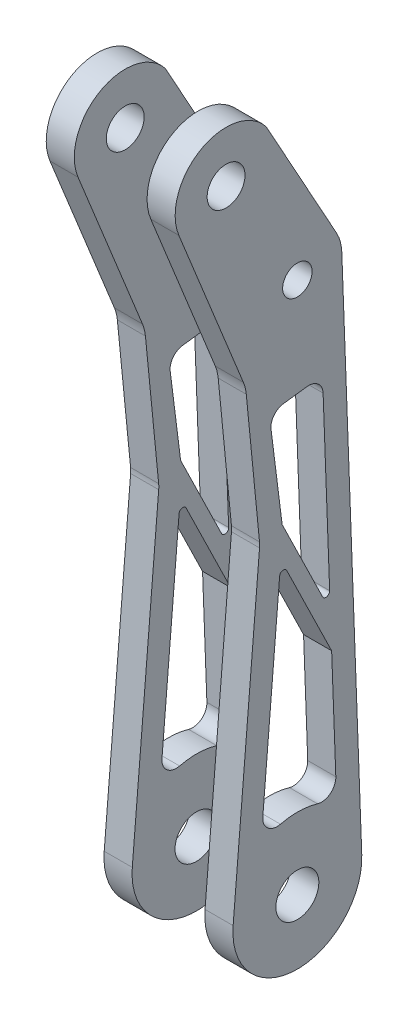
from build123d import *

# Parameters (mm, degrees)
SKETCH6_R           = 3.2639
SKETCH6_R_2         = 4.19989
BOSS_EXTRUDE3_DEPTH = 14.2875
SKETCH7_R           = 4.7625
CUT_EXTRUDE1_DEPTH  = 7.14375
SKETCH8_R           = 7.9375
CUT_EXTRUDE2_DEPTH  = 5.55625
CUT_EXTRUDE3_DEPTH  = 29.21
CUT_EXTRUDE5_DEPTH  = 28.575
FILLET2_R           = 3.175
FILLET3_R           = 3.175
BOSS_EXTRUDE4_DEPTH = 6.223
FILLET4_R           = 0.8255
BOSS_EXTRUDE5_DEPTH = 6.223
FILLET6_R           = 0.8255


with BuildPart() as part:
    # Sketch6 → Boss-Extrude3 (new, symmetric)
    with BuildSketch(Plane(origin=(0, 0, 0), x_dir=(0, 0, -1), z_dir=(1, 0, 0))):
        with BuildLine():
            Line((-8.381868112, 70.779690611), (-14.237180291, 1.198062439))
            ThreePointArc((-14.237180291, 1.198062439), (-0.331752192, -14.283647879), (14.277450567, 0.53578125))
            Line((14.277450567, 0.53578125), (11.553393182, 73.126217476))
            Line((11.553393182, 73.126217476), (9.854739755, 118.39178125))
            ThreePointArc((9.854739755, 118.39178125), (9.530289118, 120.556972634), (8.73611616, 122.597220477))
            Line((8.73611616, 122.597220477), (-6.910022509, 150.896463863))
            ThreePointArc((-6.910022509, 150.896463863), (-21.450180104, 153.711509321), (-26.264611031, 139.705727705))
            Line((-26.264611031, 139.705727705), (-11.969665934, 104.365862186))
            ThreePointArc((-11.969665934, 104.365862186), (-11.552306922, 103.075438538), (-11.323296274, 101.738675336))
            Line((-11.323296274, 101.738675336), (-8.390034626, 71.934102831))
            ThreePointArc((-8.390034626, 71.934102831), (-8.359662681, 71.357082692), (-8.381868112, 70.779690611))
        make_face()
        with Locations((0, 118.021968393)):
            Circle(SKETCH6_R, mode=Mode.SUBTRACT)
        with Locations((-15.799642553, 143.938798421)):
            Circle(SKETCH6_R_2, mode=Mode.SUBTRACT)
    extrude(amount=BOSS_EXTRUDE3_DEPTH, both=True)

    # Sketch7 → Cut-Extrude1 (cut)
    with BuildSketch(Plane(origin=(14.2875, 0, 0), x_dir=(0, 0, -1), z_dir=(1, 0, 0))):
        Circle(SKETCH7_R)
    cut_extrude1 = extrude(amount=-CUT_EXTRUDE1_DEPTH, mode=Mode.SUBTRACT)

    # Sketch8 → Cut-Extrude2 (cut)
    with BuildSketch(Plane(origin=(7.14375, 0, 0), x_dir=(0, 0, -1), z_dir=(1, 0, 0))):
        Circle(SKETCH8_R)
    cut_extrude2 = extrude(amount=-CUT_EXTRUDE2_DEPTH, mode=Mode.SUBTRACT)

    # Mirror1: Cut-Extrude2 across plane
    add(cut_extrude2.mirror(Plane(origin=(0, 0, 0), x_dir=(0, 0, 1), z_dir=(1, 0, 0))), mode=Mode.SUBTRACT)

    # Mirror2: Cut-Extrude1 across plane
    add(cut_extrude1.mirror(Plane(origin=(0, 0, 0), x_dir=(0, 0, 1), z_dir=(1, 0, 0))), mode=Mode.SUBTRACT)

    # Sketch10 → Cut-Extrude3 (cut, symmetric)
    with BuildSketch(Plane(origin=(0, 0, 14.237180291), x_dir=(-1, 0, 0), z_dir=(0, 0, -1))):
        with BuildLine():
            Line((-8.0645, 155.976463863), (-8.0645, -18.648536137))
            ThreePointArc((-8.0645, -18.648536137), (-7.13456403, -20.893600167), (-4.8895, -21.823536137))
            Line((-4.8895, -21.823536137), (4.8895, -21.823536137))
            ThreePointArc((4.8895, -21.823536137), (7.13456403, -20.893600167), (8.0645, -18.648536137))
            Line((8.0645, -18.648536137), (8.0645, 155.976463863))
            Line((8.0645, 155.976463863), (-8.0645, 155.976463863))
        make_face()
    extrude(amount=CUT_EXTRUDE3_DEPTH, both=True, mode=Mode.SUBTRACT)


with BuildPart() as cut_extrude3_piece_1:
    # of the separate pieces the step leaves, piece 1, a body of its own (cut_extrude3_pieces)
    add(part.part.solids().sort_by_distance((-8.0645, 139.705727705, 26.264611031))[0])


with BuildPart() as cut_extrude3_piece_2:
    # of the separate pieces the step leaves, piece 2, a body of its own (cut_extrude3_pieces)
    add(part.part.solids().sort_by_distance((14.2875, 139.705727705, 26.264611031))[0])


with BuildPart() as cut_extrude5_tool:
    # Sketch13 → Cut-Extrude5 (new body)
    with BuildSketch(Plane(origin=(14.2875, 0, 0), x_dir=(0, 0, -1), z_dir=(1, 0, 0))):
        with BuildLine():
            Line((-3.369379853, 72.742718267), (-6.230490775, 95.422966156))
            Line((-6.230490775, 95.422966156), (5.577203891, 96.912505615))
            Line((5.577203891, 96.912505615), (8.716072329, 13.26822174))
            ThreePointArc((8.716072329, 13.26822174), (0.368613547, 15.870719866), (-8.090670188, 13.658575362))
            Line((-8.090670188, 13.658575362), (-3.319759564, 70.353712855))
            ThreePointArc((-3.319759564, 70.353712855), (-3.281968474, 71.549515806), (-3.369379853, 72.742718267))
        make_face()
    extrude(amount=-CUT_EXTRUDE5_DEPTH)


with BuildPart() as cut_extrude3_piece_1_1:
    add(cut_extrude3_piece_1.part)

    # Cut-Extrude5: cut by cut_extrude5_tool
    add(cut_extrude5_tool.part, mode=Mode.SUBTRACT)

    # Fillet2
    fillet2_edges = [cut_extrude3_piece_1_1.edges().sort_by_distance(p)[0] for p in [
        (-11.176, 95.422966156, 6.230490775),
        (-11.176, 96.912505615, -5.577203891),
        (-11.176, 13.26822174, -8.716072329),
        (-11.176, 13.658575362, 8.090670188),
    ]]
    fillet(fillet2_edges, radius=FILLET2_R)

    # Sketch23 → Boss-Extrude5 (add)
    with BuildSketch(Plane(origin=(-14.2875, 0, -12.7), x_dir=(0, 0, -1), z_dir=(1, 0, 0))):
        with BuildLine():
            Line((-16.361406478, 74.242085268), (-5.432185966, 51.861278542))
            Line((-5.432185966, 51.861278542), (-5.138058737, 44.023402597))
            Line((-5.138058737, 44.023402597), (-16.310243165, 66.901749696))
            Line((-16.310243165, 66.901749696), (-16.019759564, 70.353712855))
            ThreePointArc((-16.019759564, 70.353712855), (-16.023369976, 72.312591024), (-16.361406478, 74.242085268))
        make_face()
    extrude(amount=BOSS_EXTRUDE5_DEPTH)

    # Fillet6
    fillet6_edges = [cut_extrude3_piece_1_1.edges().sort_by_distance(p)[0] for p in [
        (-11.176, 66.901749696, 3.610243165),
        (-11.176, 51.861278542, -7.267814034),
    ]]
    fillet(fillet6_edges, radius=FILLET6_R)


with BuildPart() as cut_extrude3_piece_2_1:
    add(cut_extrude3_piece_2.part)

    # Cut-Extrude5: cut by cut_extrude5_tool
    add(cut_extrude5_tool.part, mode=Mode.SUBTRACT)

    # Fillet3
    fillet3_edges = [cut_extrude3_piece_2_1.edges().sort_by_distance(p)[0] for p in [
        (11.176, 95.422966156, 6.230490775),
        (11.176, 96.912505615, -5.577203891),
        (11.176, 13.26822174, -8.716072329),
        (11.176, 13.658575362, 8.090670188),
    ]]
    fillet(fillet3_edges, radius=FILLET3_R)

    # Sketch21 → Boss-Extrude4 (add)
    with BuildSketch(Plane(origin=(14.2875, 0, 0), x_dir=(0, 0, -1), z_dir=(1, 0, 0))):
        with BuildLine():
            Line((-3.369379853, 72.742718267), (7.304454361, 50.884890412))
            Line((7.304454361, 50.884890412), (7.59858159, 43.047014467))
            Line((7.59858159, 43.047014467), (-3.674943248, 66.132885981))
            Line((-3.674943248, 66.132885981), (-3.319759564, 70.353712855))
            ThreePointArc((-3.319759564, 70.353712855), (-3.281968474, 71.549515806), (-3.369379853, 72.742718267))
        make_face()
    extrude(amount=-BOSS_EXTRUDE4_DEPTH)

    # Fillet4
    fillet4_edges = [cut_extrude3_piece_2_1.edges().sort_by_distance(p)[0] for p in [
        (11.176, 66.132885981, 3.674943248),
        (11.176, 50.884890412, -7.304454361),
    ]]
    fillet(fillet4_edges, radius=FILLET4_R)


solid = Compound([cut_extrude3_piece_1_1.part, cut_extrude3_piece_2_1.part])
